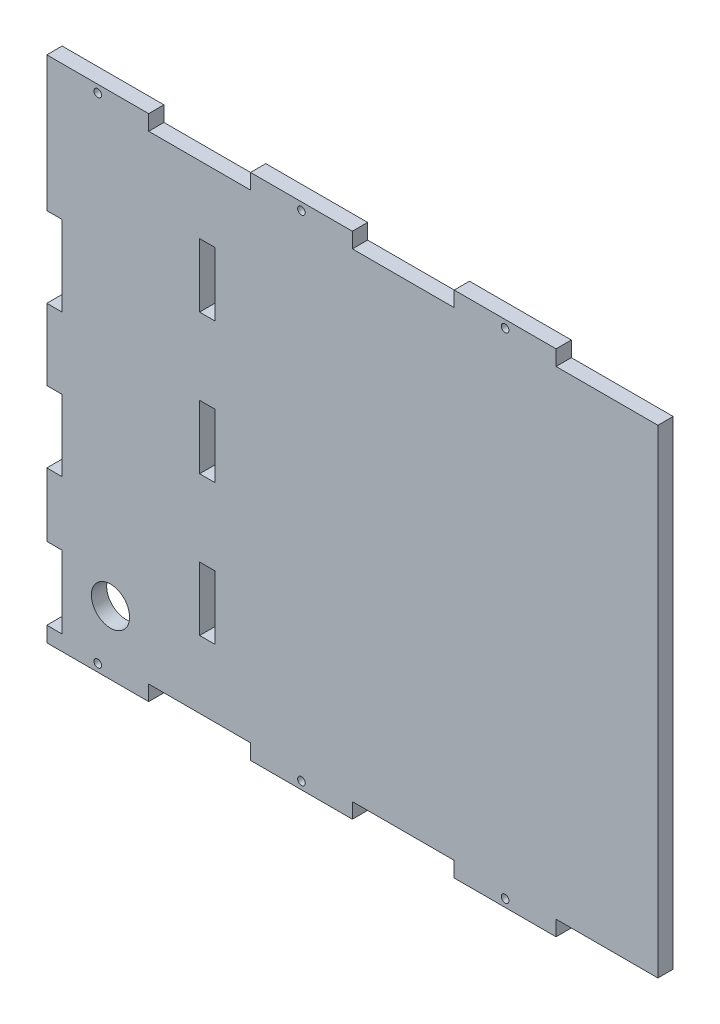
from build123d import *

# Parameters (mm, degrees)
ESQUISSE1_W             = 270
ESQUISSE1_H             = 200
BOSS_EXTRU_1_DEPTH      = 6
ESQUISSE2_R             = 7.5
ENL_V_MAT_EXTRU_1_DEPTH = 10
ESQUISSE4_W             = 40
ESQUISSE4_H             = 6
ESQUISSE4_W_2           = 6
ESQUISSE4_H_2           = 50
ESQUISSE4_H_3           = 40
ENL_V_MAT_EXTRU_2_DEPTH = 6
ESQUISSE5_W             = 6
ESQUISSE5_H             = 25
ENL_V_MAT_EXTRU_3_DEPTH = 10
ESQUISSE6_W             = 30.179320299
ESQUISSE6_H             = 200.522044325
ENL_V_MAT_EXTRU_4_DEPTH = 169.110082981
ESQUISSE7_R             = 2.995
ENL_V_MAT_EXTRU_5_DEPTH = 3
ESQUISSE8_R             = 1.5
ENL_V_MAT_EXTRU_6_DEPTH = 13
ESQUISSE9_W             = 6
ESQUISSE9_H             = 28.5
ESQUISSE9_H_2           = 28
ESQUISSE9_H_3           = 31.5
ENL_V_MAT_EXTRU_7_DEPTH = 10


with BuildPart() as part:
    # Esquisse1 → Boss.-Extru.1 (new body)
    with BuildSketch(Plane.XY):
        Rectangle(ESQUISSE1_W, ESQUISSE1_H)
    extrude(amount=BOSS_EXTRU_1_DEPTH)

    # Esquisse2 → Enlèv. mat.-Extru.1 (cut)
    with BuildSketch(Plane(origin=(0, 0, 0), x_dir=(-1, 0, 0), z_dir=(0, 0, -1))):
        with Locations((110, -75)):
            Circle(ESQUISSE2_R)
    extrude(amount=-ENL_V_MAT_EXTRU_1_DEPTH, mode=Mode.SUBTRACT)

    # Esquisse4 → Enlèv. mat.-Extru.2 (cut)
    with BuildSketch(Plane.XY.offset(6)):
        with Locations((-75, -97)):
            Rectangle(ESQUISSE4_W, ESQUISSE4_H)
        with Locations((5, -97)):
            Rectangle(ESQUISSE4_W, ESQUISSE4_H)
        with Locations((85, -97)):
            Rectangle(ESQUISSE4_W, ESQUISSE4_H)
        with Locations((-75, 97)):
            Rectangle(ESQUISSE4_W, ESQUISSE4_H)
        with Locations((5, 97)):
            Rectangle(ESQUISSE4_W, ESQUISSE4_H)
        with Locations((85, 97)):
            Rectangle(ESQUISSE4_W, ESQUISSE4_H)
        with Locations((132, -75)):
            Rectangle(ESQUISSE4_W_2, ESQUISSE4_H_2)
        with Locations((132, 75)):
            Rectangle(ESQUISSE4_W_2, ESQUISSE4_H_2)
        with Locations((132, 0)):
            Rectangle(ESQUISSE4_W_2, ESQUISSE4_H_3)
    extrude(amount=-ENL_V_MAT_EXTRU_2_DEPTH, mode=Mode.SUBTRACT)

    # Esquisse5 → Enlèv. mat.-Extru.3 (cut)
    with BuildSketch(Plane(origin=(0, 0, 0), x_dir=(-1, 0, 0), z_dir=(0, 0, -1))):
        with Locations((72, -55)):
            Rectangle(ESQUISSE5_W, ESQUISSE5_H)
        with Locations((72, 0)):
            Rectangle(ESQUISSE5_W, ESQUISSE5_H)
        with Locations((72, 55)):
            Rectangle(ESQUISSE5_W, ESQUISSE5_H)
    extrude(amount=-ENL_V_MAT_EXTRU_3_DEPTH, mode=Mode.SUBTRACT)

    # Esquisse6 → Enlèv. mat.-Extru.4 (cut, through all)
    with BuildSketch(Plane.XY.offset(6)):
        with Locations((120.08966015, -0.261022163)):
            Rectangle(ESQUISSE6_W, ESQUISSE6_H)
    extrude(amount=-ENL_V_MAT_EXTRU_4_DEPTH, mode=Mode.SUBTRACT)

    # Esquisse7 → Enlèv. mat.-Extru.5 (cut)
    with BuildSketch(Plane(origin=(0, 0, 0), x_dir=(-1, 0, 0), z_dir=(0, 0, -1))):
        with Locations((-45, 97)):
            Circle(ESQUISSE7_R)
        with Locations((35, 97)):
            Circle(ESQUISSE7_R)
        with Locations((115, 97)):
            Circle(ESQUISSE7_R)
        with Locations((-45, -97)):
            Circle(ESQUISSE7_R)
        with Locations((35, -97)):
            Circle(ESQUISSE7_R)
        with Locations((115, -97)):
            Circle(ESQUISSE7_R)
    extrude(amount=-ENL_V_MAT_EXTRU_5_DEPTH, mode=Mode.SUBTRACT)

    # Esquisse8 → Enlèv. mat.-Extru.6 (cut)
    with BuildSketch(Plane(origin=(0, 0, 0), x_dir=(-1, 0, 0), z_dir=(0, 0, -1))):
        with Locations((-45, 97)):
            Circle(ESQUISSE8_R)
        with Locations((35, 97)):
            Circle(ESQUISSE8_R)
        with Locations((115, 97)):
            Circle(ESQUISSE8_R)
        with Locations((-45, -97)):
            Circle(ESQUISSE8_R)
        with Locations((35, -97)):
            Circle(ESQUISSE8_R)
        with Locations((115, -97)):
            Circle(ESQUISSE8_R)
    extrude(amount=-ENL_V_MAT_EXTRU_6_DEPTH, mode=Mode.SUBTRACT)

    # Esquisse9 → Enlèv. mat.-Extru.7 (cut)
    with BuildSketch(Plane(origin=(0, 0, 0), x_dir=(-1, 0, 0), z_dir=(0, 0, -1))):
        with Locations((132, -79.75)):
            Rectangle(ESQUISSE9_W, ESQUISSE9_H)
        with Locations((132, -26.5)):
            Rectangle(ESQUISSE9_W, ESQUISSE9_H_2)
        with Locations((132, 31.25)):
            Rectangle(ESQUISSE9_W, ESQUISSE9_H_3)
    extrude(amount=-ENL_V_MAT_EXTRU_7_DEPTH, mode=Mode.SUBTRACT)


solid = part.part
